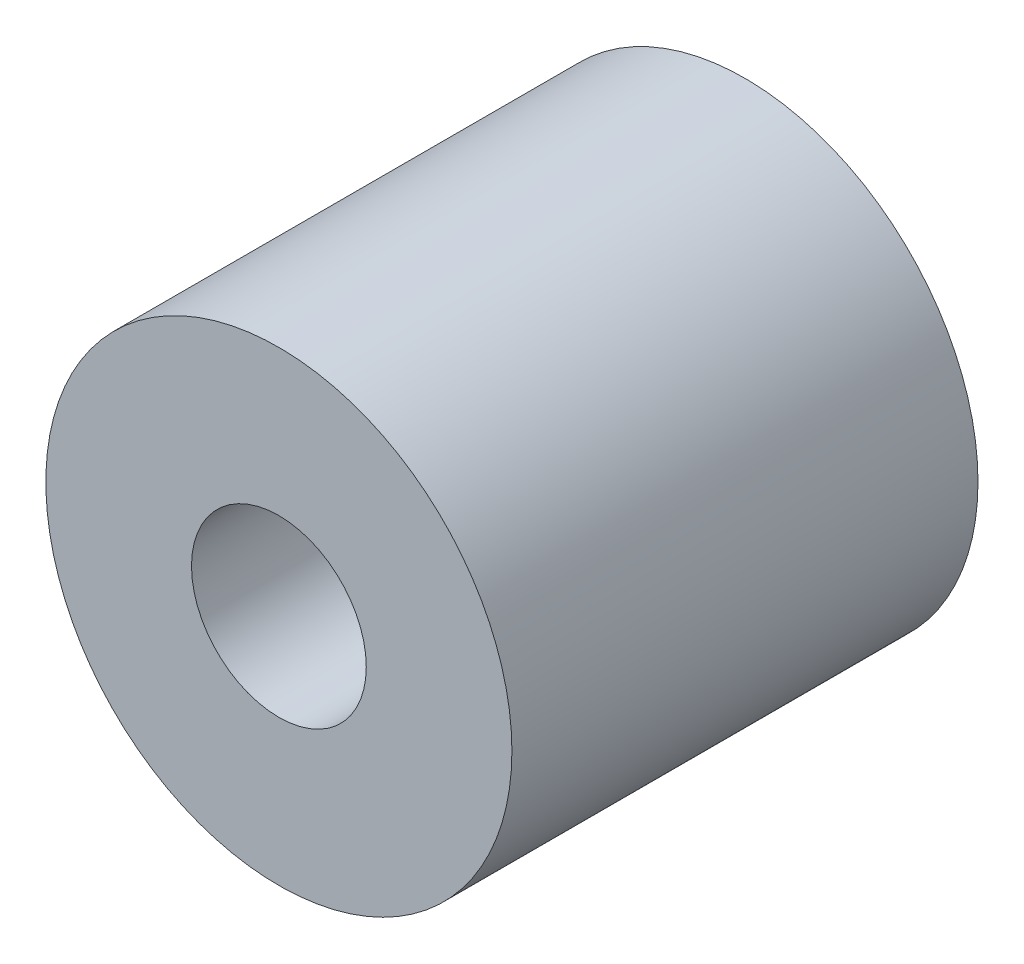
from build123d import *

# Parameters (mm, degrees)
SKETCH1_R           = 12.7
SKETCH1_R_2         = 4.7625
BOSS_EXTRUDE1_DEPTH = 25.4


with BuildPart() as part:
    # Sketch1 → Boss-Extrude1 (new body)
    with BuildSketch(Plane.XY):
        Circle(SKETCH1_R)
        Circle(SKETCH1_R_2, mode=Mode.SUBTRACT)
    extrude(amount=BOSS_EXTRUDE1_DEPTH)


solid = part.part
